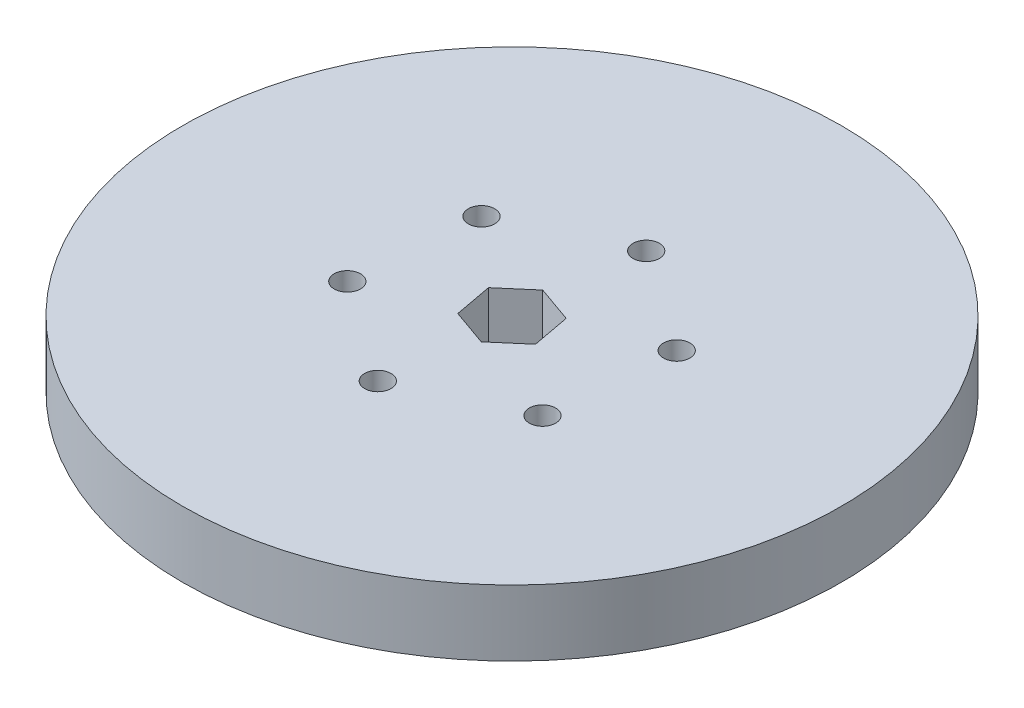
from build123d import *

# Parameters (mm, degrees)
SKETCH1_R           = 63.5
BOSS_EXTRUDE1_DEPTH = 12.7
SKETCH7_R           = 2.54
CUT_EXTRUDE2_DEPTH  = 91.696141042
CUT_EXTRUDE3_DEPTH  = 91.696141042


with BuildPart() as part:
    # Sketch1 → Boss-Extrude1 (new body)
    with BuildSketch(Plane(origin=(0, 0, 0), x_dir=(1, 0, 0), z_dir=(0, 1, 0))):
        with Locations(Location((0, 0, 0), (0, 0, 270))):
            Circle(SKETCH1_R)
    extrude(amount=-BOSS_EXTRUDE1_DEPTH)

    # Sketch7 → Cut-Extrude2 (cut, through all)
    with BuildSketch(Plane(origin=(0, 0, 0), x_dir=(1, 0, 0), z_dir=(0, 1, 0))):
        with Locations(Location((19.563011922, -13.687656502, 0), (0, 0, 270))):
            Circle(SKETCH7_R)
        with Locations(Location((21.635364211, 10.098237048, 0), (0, 0, 270))):
            Circle(SKETCH7_R)
        with Locations(Location((2.072352288, 23.78589355, 0), (0, 0, 270))):
            Circle(SKETCH7_R)
        with Locations(Location((-19.563011922, 13.687656502, 0), (0, 0, 270))):
            Circle(SKETCH7_R)
        with Locations(Location((-21.635364211, -10.098237048, 0), (0, 0, 270))):
            Circle(SKETCH7_R)
        with Locations(Location((-2.072352288, -23.78589355, 0), (0, 0, 270))):
            Circle(SKETCH7_R)
    extrude(amount=-CUT_EXTRUDE2_DEPTH, mode=Mode.SUBTRACT)

    # Sketch8 → Cut-Extrude3 (cut, through all)
    with BuildSketch(Plane(origin=(0, 0, 0), x_dir=(1, 0, 0), z_dir=(0, 1, 0))):
        Polygon((-5.623469851, -4.818771956), (1.361444003, -7.279453727), (6.984913855, -2.46068177), (5.623469851, 4.818771956), (-1.361444003, 7.279453727), (-6.984913855, 2.46068177), align=None)
    extrude(amount=-CUT_EXTRUDE3_DEPTH, mode=Mode.SUBTRACT)


solid = part.part
